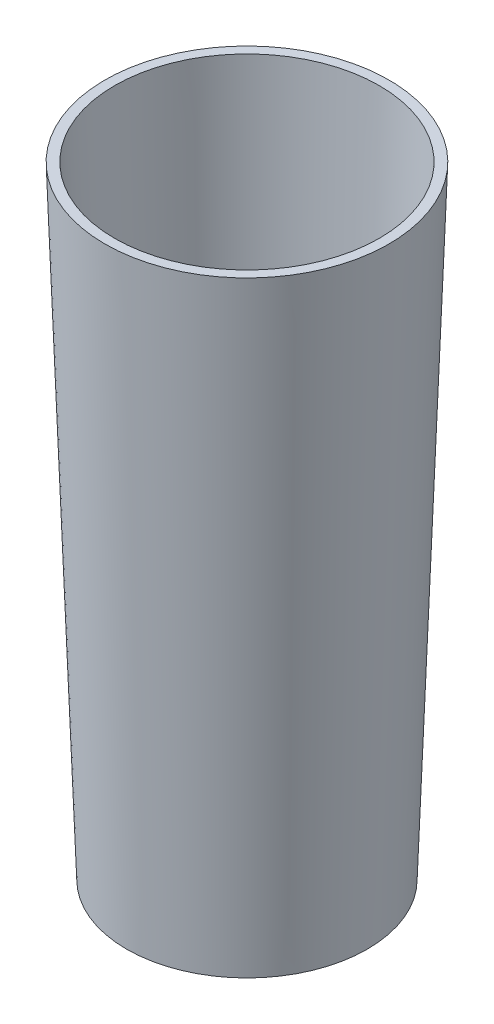
from build123d import *

# Parameters (mm, degrees)
SKETCH1_R           = 6.195
BOSS_EXTRUDE1_DEPTH = 32
BOSS_EXTRUDE1_DRAFT = -2
SKETCH3_R           = 5.695
CUT_EXTRUDE1_DEPTH  = 50.7
CUT_EXTRUDE1_DRAFT  = 2


with BuildPart() as part:
    # Sketch1 → Boss-Extrude1 (with draft: the straight prism first)
    with BuildSketch(Plane(origin=(0, 0, 0), x_dir=(1, 0, 0), z_dir=(0, 1, 0))):
        Circle(SKETCH1_R)
    extrude(amount=BOSS_EXTRUDE1_DEPTH)
    # Boss-Extrude1: the draft: its side faces are tilted about the plane it starts from
    boss_extrude1_sides = [part.faces().sort_by_distance(p)[0] for p in [
        (-6.195, 16, 0),
    ]]
    draft(boss_extrude1_sides, Plane(origin=(0, 0, 0), x_dir=(1, 0, 0), z_dir=(0, 1, 0)), BOSS_EXTRUDE1_DRAFT)


with BuildPart() as cut_extrude1_tool:
    # Sketch3 → Cut-Extrude1 (with draft: the straight prism first)
    with BuildSketch(Plane(origin=(0, 0, 0), x_dir=(-1, 0, 0), z_dir=(0, -1, 0))):
        Circle(SKETCH3_R)
    extrude(amount=-CUT_EXTRUDE1_DEPTH)
    # Cut-Extrude1: the draft: its side faces are tilted about the plane it starts from
    cut_extrude1_sides = [cut_extrude1_tool.faces().sort_by_distance(p)[0] for p in [
        (5.695, 25.35, 0),
    ]]
    draft(cut_extrude1_sides, Plane(origin=(0, 0, 0), x_dir=(-1, 0, 0), z_dir=(0, -1, 0)), CUT_EXTRUDE1_DRAFT)


with BuildPart() as part_1:
    add(part.part)

    # Cut-Extrude1: cut by cut_extrude1_tool
    add(cut_extrude1_tool.part, mode=Mode.SUBTRACT)


solid = part_1.part
